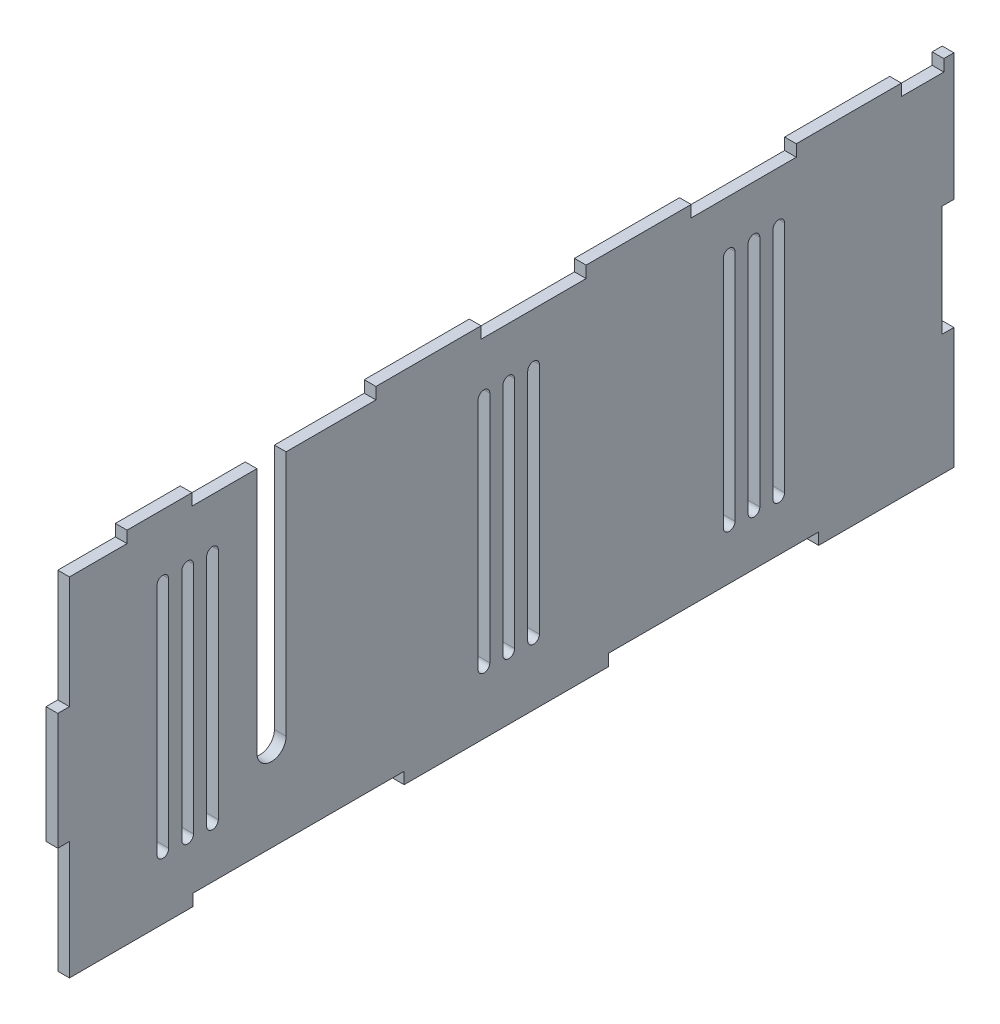
from build123d import *

# Parameters (mm, degrees)
SKETCH1_W           = 307
SKETCH1_H           = 115
BOSS_EXTRUDE1_DEPTH = 4
CUT_EXTRUDE1_DEPTH  = 4
SKETCH3_W           = 4
SKETCH3_H           = 40.5
SKETCH3_H_2         = 38.5
CUT_EXTRUDE2_DEPTH  = 4
SKETCH4_W           = 46.333333333
SKETCH4_H           = 4
SKETCH4_W_2         = 42.33
BOSS_EXTRUDE3_DEPTH = 4
SKETCH5_W           = 36
SKETCH5_H           = 4
BOSS_EXTRUDE4_DEPTH = 4
SKETCH7_W           = 22.24
SKETCH7_H           = 4
BOSS_EXTRUDE6_DEPTH = 4
SKETCH8_W           = 4
SKETCH8_H           = 38
CUT_EXTRUDE3_DEPTH  = 4
LPATTERN1_COUNT     = 3
LPATTERN1_PITCH     = 72
SKETCH9_W           = 70
SKETCH9_H           = 4
BOSS_EXTRUDE7_DEPTH = 4
CUT_EXTRUDE4_DEPTH  = 4
LPATTERN2_COUNT     = 2
LPATTERN2_PITCH     = 84
LPATTERN3_COUNT     = 2
LPATTERN3_PITCH     = 194
SKETCH11_W          = 4
SKETCH11_H          = 3.457617008
BOSS_EXTRUDE8_DEPTH = 4


with BuildPart() as part:
    # Sketch1 → Boss-Extrude1 (new body)
    with BuildSketch(Plane(origin=(0, 0, 0), x_dir=(0, 0, -1), z_dir=(1, 0, 0))):
        with Locations((153.5, 57.5)):
            Rectangle(SKETCH1_W, SKETCH1_H)
    extrude(amount=BOSS_EXTRUDE1_DEPTH)

    # Sketch2 → Cut-Extrude1 (cut)
    with BuildSketch(Plane.ZY):
        with BuildLine():
            Line((-78.216729868, 30.591924331), (-78.216729868, 118.288831206))
            Line((-78.216729868, 118.288831206), (-68.216729868, 118.288831206))
            Line((-68.216729868, 118.288831206), (-68.216729868, 30.591924331))
            ThreePointArc((-68.216729868, 30.591924331), (-73.216729868, 25.591924331), (-78.216729868, 30.591924331))
        make_face()
    extrude(amount=-CUT_EXTRUDE1_DEPTH, mode=Mode.SUBTRACT)

    # Sketch3 → Cut-Extrude2 (cut)
    with BuildSketch(Plane.ZY):
        with Locations((-2, 16.25)):
            Rectangle(SKETCH3_W, SKETCH3_H)
        with Locations((-2, 95.75)):
            Rectangle(SKETCH3_W, SKETCH3_H_2)
    extrude(amount=-CUT_EXTRUDE2_DEPTH, mode=Mode.SUBTRACT)

    # Sketch4 → Boss-Extrude3 (add)
    with BuildSketch(Plane.ZY):
        with Locations((-283.833333334, -2)):
            Rectangle(SKETCH4_W, SKETCH4_H)
        with Locations((-25.165, -2)):
            Rectangle(SKETCH4_W_2, SKETCH4_H)
    extrude(amount=-BOSS_EXTRUDE3_DEPTH)

    # Sketch5 → Boss-Extrude4 (add)
    with BuildSketch(Plane.ZY):
        with Locations((-271, 117)):
            Rectangle(SKETCH5_W, SKETCH5_H)
    boss_extrude4 = extrude(amount=-BOSS_EXTRUDE4_DEPTH)

    # Sketch7 → Boss-Extrude6 (add)
    with BuildSketch(Plane.ZY):
        with Locations((-34.856729868, 117)):
            Rectangle(SKETCH7_W, SKETCH7_H)
    extrude(amount=-BOSS_EXTRUDE6_DEPTH)

    # Sketch8 → Cut-Extrude3 (cut)
    with BuildSketch(Plane.ZY):
        with Locations((-305, 56.5)):
            Rectangle(SKETCH8_W, SKETCH8_H)
    extrude(amount=-CUT_EXTRUDE3_DEPTH, mode=Mode.SUBTRACT)

    # LPattern1: Boss-Extrude4 ×3
    with Locations(*[(0, 0, i * LPATTERN1_PITCH) for i in range(1, LPATTERN1_COUNT)]):
        add(boss_extrude4)

    # Sketch9 → Boss-Extrude7 (add)
    with BuildSketch(Plane.ZY):
        with Locations((-153.666666667, -2)):
            Rectangle(SKETCH9_W, SKETCH9_H)
    extrude(amount=-BOSS_EXTRUDE7_DEPTH)

    # Sketch10 → Cut-Extrude4 (cut)
    with BuildSketch(Plane.ZY):
        with BuildLine():
            Line((-245, 97.5), (-245, 17.5))
            ThreePointArc((-245, 17.5), (-247, 15.5), (-249, 17.5))
            Line((-249, 17.5), (-249, 97.5))
            ThreePointArc((-249, 97.5), (-247, 99.5), (-245, 97.5))
        make_face()
        with BuildLine():
            Line((-240.5, 97.5), (-240.5, 17.5))
            ThreePointArc((-240.5, 17.5), (-238.5, 15.5), (-236.5, 17.5))
            Line((-236.5, 17.5), (-236.5, 97.5))
            ThreePointArc((-236.5, 97.5), (-238.5, 99.5), (-240.5, 97.5))
        make_face()
        with BuildLine():
            Line((-232, 97.5), (-232, 17.5))
            ThreePointArc((-232, 17.5), (-230, 15.5), (-228, 17.5))
            Line((-228, 17.5), (-228, 97.5))
            ThreePointArc((-228, 97.5), (-230, 99.5), (-232, 97.5))
        make_face()
    cut_extrude4 = extrude(amount=-CUT_EXTRUDE4_DEPTH, mode=Mode.SUBTRACT)

    # LPattern2: Cut-Extrude4 ×2
    with Locations(*[(0, 0, i * LPATTERN2_PITCH) for i in range(1, LPATTERN2_COUNT)]):
        add(cut_extrude4, mode=Mode.SUBTRACT)

    # LPattern3: Cut-Extrude4 ×2
    with Locations(*[(0, 0, i * LPATTERN3_PITCH) for i in range(1, LPATTERN3_COUNT)]):
        add(cut_extrude4, mode=Mode.SUBTRACT)

    # Sketch11 → Boss-Extrude8 (add)
    with BuildSketch(Plane(origin=(0, 115, 0), x_dir=(1, 0, 0), z_dir=(0, 1, 0))):
        with Locations((2, 305.271191496)):
            Rectangle(SKETCH11_W, SKETCH11_H)
    extrude(amount=BOSS_EXTRUDE8_DEPTH)


solid = part.part
